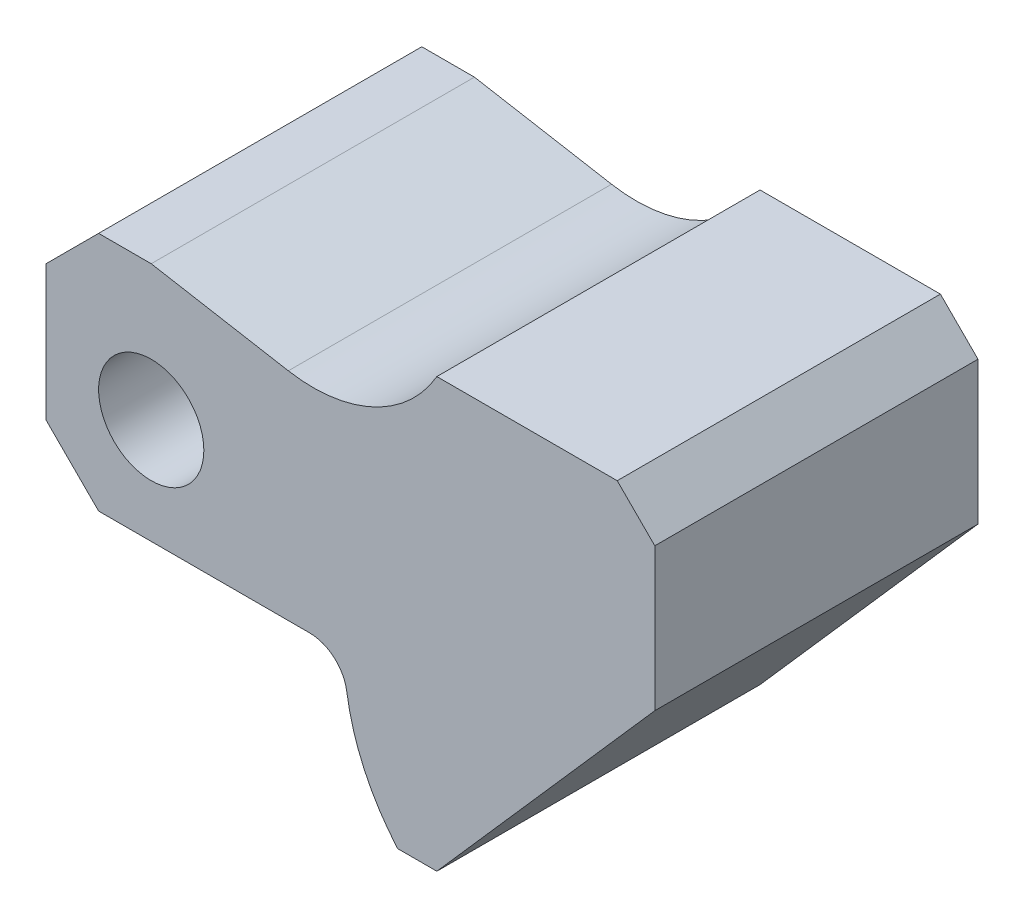
from build123d import *

# Parameters (mm, degrees)
ESQUISSE1_R        = 7
BOSS_EXTRU_1_DEPTH = 43
CHANFREIN1_SIZE    = 7
CHANFREIN2_SIZE    = 5


with BuildPart() as part:
    # Esquisse1 → Boss.-Extru.1 (new body)
    with BuildSketch(Plane.XY):
        with BuildLine():
            Line((-14, 18), (0, 18))
            Line((0, 18), (18.243084988, 14.783251905))
            ThreePointArc((18.243084988, 14.783251905), (29.574972961, 16.276069151), (38, 24))
            Line((38, 24), (62, 24))
            Line((62, 24), (67, 24))
            Line((67, 24), (67, 0))
            Line((67, 0), (38, -33))
            Line((38, -33), (32.788067397, -33))
            ThreePointArc((32.788067397, -33), (28.3490952, -26.115672061), (26.012264997, -18.264705882))
            ThreePointArc((26.012264997, -18.264705882), (24.331862036, -15.213413768), (21.066626255, -14))
            Line((21.066626255, -14), (-14, -14))
            Line((-14, -14), (-14, 18))
        make_face()
        Circle(ESQUISSE1_R, mode=Mode.SUBTRACT)
    extrude(amount=BOSS_EXTRU_1_DEPTH)

    # Chanfrein1
    chanfrein1_edges = [part.edges().sort_by_distance(p)[0] for p in [
        (-14, -14, 21.5),
        (-14, 18, 21.5),
    ]]
    chamfer(chanfrein1_edges, length=CHANFREIN1_SIZE)

    # Chanfrein2
    chanfrein2_edges = [part.edges().sort_by_distance(p)[0] for p in [
        (67, 24, 21.5),
    ]]
    chamfer(chanfrein2_edges, length=CHANFREIN2_SIZE)


solid = part.part
